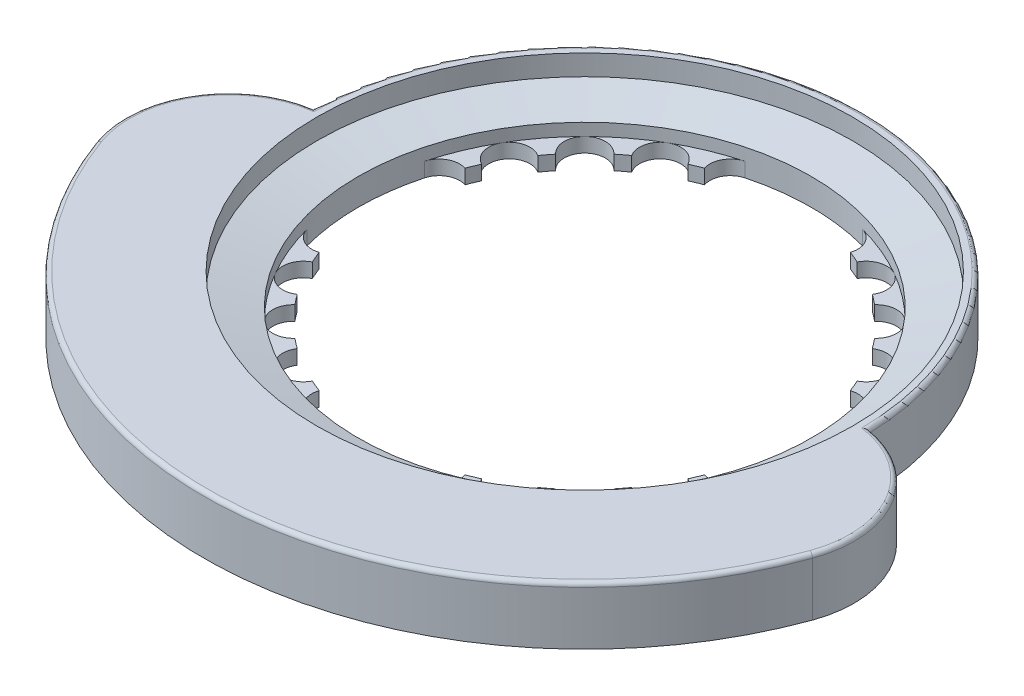
from build123d import *

# Parameters (mm, degrees)
SKETCH_1_R          = 13.5
EXTRUDE_1_DEPTH     = 2.8
SKETCH_2_R          = 13
CUT_EXTRUDE_1_DEPTH = 1
SKETCH_5_R          = 11
CUT_EXTRUDE_2_DEPTH = 0.6
CUT_EXTRUDE_3_DEPTH = 0.7
EXTRUDE_2_DEPTH     = 2.8
FILLET_1_R          = 0.2


with BuildPart() as part:
    # 草图1 → 凸台-拉伸1 (new body)
    with BuildSketch(Plane(origin=(0, 0, 0), x_dir=(1, 0, 0), z_dir=(0, 1, 0))):
        with Locations(Location((0, 0, 0), (0, 0, 270))):
            Circle(SKETCH_1_R)
    extrude(amount=EXTRUDE_1_DEPTH)

    # 草图2 → 切除-拉伸1 (cut)
    with BuildSketch(Plane(origin=(0, 2.8, 0), x_dir=(1, 0, 0), z_dir=(0, 1, 0))):
        with Locations(Location((0, 0, 0), (0, 0, 270))):
            Circle(SKETCH_2_R)
    extrude(amount=-CUT_EXTRUDE_1_DEPTH, mode=Mode.SUBTRACT)

    # 草图4 → 切除-旋转1 (revolve, cut)
    with BuildSketch(Plane.XY):
        Polygon((0, 1.3), (-11, 1.3), (-13, 1.8), (0, 1.8), align=None)
    revolve(axis=Axis((0, 1.8, 0), (0, -1, 0)), mode=Mode.SUBTRACT)

    # 草图5 → 切除-拉伸2 (cut)
    with BuildSketch(Plane(origin=(0, 1.3, 0), x_dir=(1, 0, 0), z_dir=(0, 1, 0))):
        with Locations(Location((0, 0, 0), (0, 0, 180))):
            Circle(SKETCH_5_R)
    extrude(amount=-CUT_EXTRUDE_2_DEPTH, mode=Mode.SUBTRACT)

    # 草图6 → 切除-拉伸3 (cut)
    with BuildSketch(Plane(origin=(0, 0.7, 0), x_dir=(1, 0, 0), z_dir=(0, 1, 0))):
        with BuildLine():
            ThreePointArc((-3.539967162, 9.352466653), (-3.826834324, 9.238795325), (-4.110057805, 9.116327377))
            ThreePointArc((-4.110057805, 9.116327377), (-5.5, 9.526279442), (-5.839942195, 8.117578159))
            ThreePointArc((-5.839942195, 8.117578159), (-6.08761429, 7.933533403), (-6.329490128, 7.741934817))
            ThreePointArc((-6.329490128, 7.741934817), (-7.778174593, 7.778174593), (-7.741934817, 6.329490128))
            ThreePointArc((-7.741934817, 6.329490128), (-7.933533403, 6.08761429), (-8.117578159, 5.839942195))
            ThreePointArc((-8.117578159, 5.839942195), (-9.526279442, 5.5), (-9.116327377, 4.110057805))
            ThreePointArc((-9.116327377, 4.110057805), (-9.238795325, 3.826834324), (-9.352466653, 3.539967162))
            ThreePointArc((-9.352466653, 3.539967162), (-10.137444482, 3.466448921), (-10.625184089, 2.847009496))
            ThreePointArc((-10.625184089, 2.847009496), (-11, 0), (-10.625184089, -2.847009496))
            ThreePointArc((-10.625184089, -2.847009496), (-10.137444482, -3.466448921), (-9.352466653, -3.539967162))
            ThreePointArc((-9.352466653, -3.539967162), (-9.238795325, -3.826834324), (-9.116327377, -4.110057805))
            ThreePointArc((-9.116327377, -4.110057805), (-9.526279442, -5.5), (-8.117578159, -5.839942195))
            ThreePointArc((-8.117578159, -5.839942195), (-7.933533403, -6.08761429), (-7.741934817, -6.329490128))
            ThreePointArc((-7.741934817, -6.329490128), (-7.778174593, -7.778174593), (-6.329490128, -7.741934817))
            ThreePointArc((-6.329490128, -7.741934817), (-6.08761429, -7.933533403), (-5.839942195, -8.117578159))
            ThreePointArc((-5.839942195, -8.117578159), (-5.5, -9.526279442), (-4.110057805, -9.116327377))
            ThreePointArc((-4.110057805, -9.116327377), (-3.826834324, -9.238795325), (-3.539967162, -9.352466653))
            ThreePointArc((-3.539967162, -9.352466653), (-3.466448921, -10.137444482), (-2.847009496, -10.625184089))
            ThreePointArc((-2.847009496, -10.625184089), (0, -11), (2.847009496, -10.625184089))
            ThreePointArc((2.847009496, -10.625184089), (3.466448921, -10.137444482), (3.539967162, -9.352466653))
            ThreePointArc((3.539967162, -9.352466653), (3.826834324, -9.238795325), (4.110057805, -9.116327377))
            ThreePointArc((4.110057805, -9.116327377), (5.5, -9.526279442), (5.839942195, -8.117578159))
            ThreePointArc((5.839942195, -8.117578159), (6.08761429, -7.933533403), (6.329490128, -7.741934817))
            ThreePointArc((6.329490128, -7.741934817), (7.778174593, -7.778174593), (7.741934817, -6.329490128))
            ThreePointArc((7.741934817, -6.329490128), (7.933533403, -6.08761429), (8.117578159, -5.839942195))
            ThreePointArc((8.117578159, -5.839942195), (9.526279442, -5.5), (9.116327377, -4.110057805))
            ThreePointArc((9.116327377, -4.110057805), (9.238795325, -3.826834324), (9.352466653, -3.539967162))
            ThreePointArc((9.352466653, -3.539967162), (10.137444482, -3.466448921), (10.625184089, -2.847009496))
            ThreePointArc((10.625184089, -2.847009496), (11, 0), (10.625184089, 2.847009496))
            ThreePointArc((10.625184089, 2.847009496), (10.137444482, 3.466448921), (9.352466653, 3.539967162))
            ThreePointArc((9.352466653, 3.539967162), (9.238795325, 3.826834324), (9.116327377, 4.110057805))
            ThreePointArc((9.116327377, 4.110057805), (9.526279442, 5.5), (8.117578159, 5.839942195))
            ThreePointArc((8.117578159, 5.839942195), (7.933533403, 6.08761429), (7.741934817, 6.329490128))
            ThreePointArc((7.741934817, 6.329490128), (7.778174593, 7.778174593), (6.329490128, 7.741934817))
            ThreePointArc((6.329490128, 7.741934817), (6.08761429, 7.933533403), (5.839942195, 8.117578159))
            ThreePointArc((5.839942195, 8.117578159), (5.5, 9.526279442), (4.110057805, 9.116327377))
            ThreePointArc((4.110057805, 9.116327377), (3.826834324, 9.238795325), (3.539967162, 9.352466653))
            ThreePointArc((3.539967162, 9.352466653), (3.466448921, 10.137444482), (2.847009496, 10.625184089))
            ThreePointArc((2.847009496, 10.625184089), (0, 11), (-2.847009496, 10.625184089))
            ThreePointArc((-2.847009496, 10.625184089), (-3.466448921, 10.137444482), (-3.539967162, 9.352466653))
        make_face()
    extrude(amount=-CUT_EXTRUDE_3_DEPTH, mode=Mode.SUBTRACT)

    # 草图7 → 凸台-拉伸2 (add)
    with BuildSketch(Plane(origin=(0, 0, 0), x_dir=(1, 0, 0), z_dir=(0, 1, 0))):
        with BuildLine():
            ThreePointArc((-17.384313485, -6.327372652), (0, -18.5), (17.384313485, -6.327372652))
            ThreePointArc((17.384313485, -6.327372652), (17.00124382, -2.09192454), (13.496286822, 0.316610185))
            ThreePointArc((13.496286822, 0.316610185), (0, -13.5), (-13.496286822, 0.316610185))
            ThreePointArc((-13.496286822, 0.316610185), (-17.00124382, -2.09192454), (-17.384313485, -6.327372652))
        make_face()
    extrude(amount=EXTRUDE_2_DEPTH)

    # 圆角1
    fillet_1_edges = [part.edges().sort_by_distance(p)[0] for p in [
        (-17.00124382, 2.8, 2.09192454),
        (0, 2.8, 18.5),
        (17.00124382, 2.8, 2.09192454),
        (0, 2.8, -13.5),
    ]]
    fillet(fillet_1_edges, radius=FILLET_1_R)


solid = part.part
